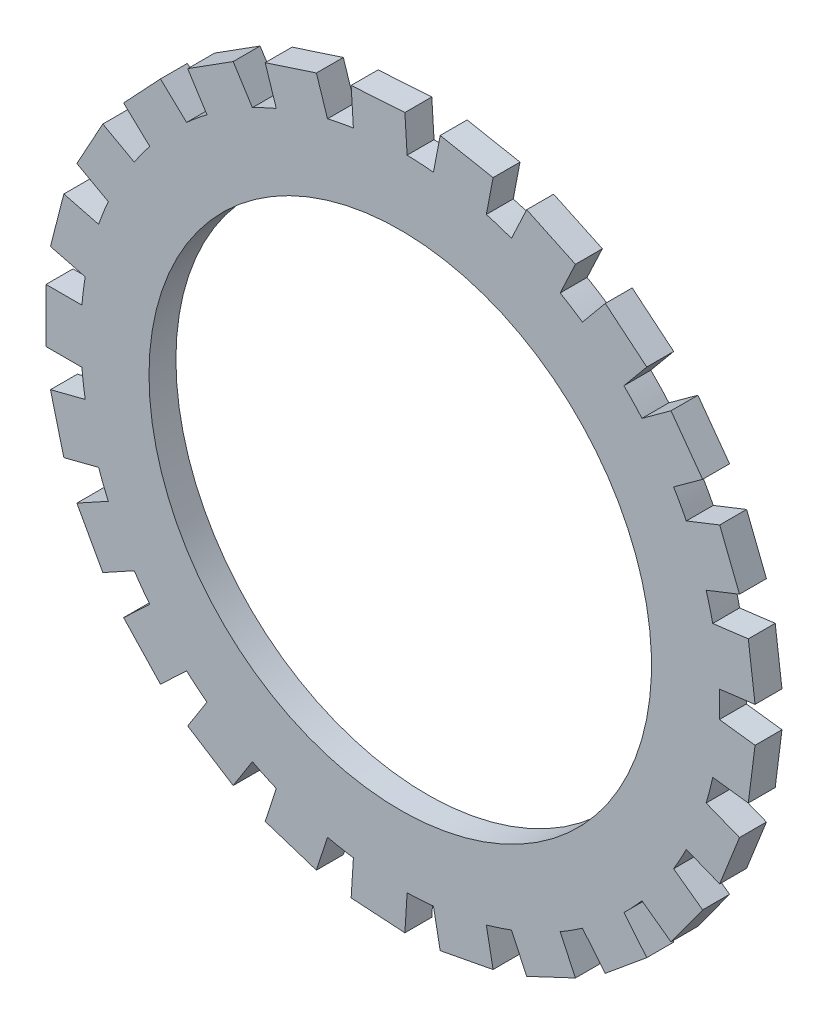
from build123d import *

# Parameters (mm, degrees)
SKETCH1_R           = 226.06
SKETCH1_R_2         = 177.8
BOSS_EXTRUDE1_DEPTH = 19.05
BOSS_EXTRUDE2_START = -19.05
BOSS_EXTRUDE2_DEPTH = 19.05


with BuildPart() as part:
    # Sketch1 → Boss-Extrude1 (new body)
    with BuildSketch(Plane.XY):
        with Locations(Location((0, 0, 0), (0, 0, 180))):
            Circle(SKETCH1_R)
        with Locations(Location((0, 0, 0), (0, 0, 180))):
            Circle(SKETCH1_R_2, mode=Mode.SUBTRACT)
    extrude(amount=BOSS_EXTRUDE1_DEPTH)

    # Sketch2 → Boss-Extrude2 (add)
    with BuildSketch(Plane.XY.offset(19.05).offset(BOSS_EXTRUDE2_START)):
        with BuildLine():
            Line((-250.655901366, 19.05), (-225.255901366, 19.05))
            ThreePointArc((-225.255901366, 19.05), (-226.06, 0), (-225.255901366, -19.05))
            Line((-225.255901366, -19.05), (-250.655901366, -19.05))
            Line((-250.655901366, -19.05), (-250.655901366, 19.05))
        make_face()
        with BuildLine():
            Line((-247.518627651, 43.884078608), (-222.916615358, 37.567355474))
            ThreePointArc((-222.916615358, 37.567355474), (-218.957909405, 56.218835892), (-213.441530657, 74.470373913))
            Line((-213.441530657, 74.470373913), (-238.04354295, 80.787097047))
            Line((-238.04354295, 80.787097047), (-247.518627651, 43.884078608))
        make_face()
        with BuildLine():
            Line((-228.828848251, 104.060759163), (-206.570658578, 91.824215841))
            ThreePointArc((-206.570658578, 91.824215841), (-198.097888091, 108.905235567), (-188.215843594, 125.211500351))
            Line((-188.215843594, 125.211500351), (-210.474033267, 137.448043673))
            Line((-210.474033267, 137.448043673), (-228.828848251, 104.060759163))
        make_face()
        with BuildLine():
            Line((-195.760910741, 157.698919511), (-177.245107605, 140.311423021))
            ThreePointArc((-177.245107605, 140.311423021), (-164.790647915, 154.748718766), (-151.163862869, 168.085127726))
            Line((-151.163862869, 168.085127726), (-169.679666006, 185.472624216))
            Line((-169.679666006, 185.472624216), (-195.760910741, 157.698919511))
        make_face()
        with BuildLine():
            Line((-150.392595252, 201.42827677), (-136.78259466, 179.982347463))
            ThreePointArc((-136.78259466, 179.982347463), (-121.129005273, 190.868770839), (-104.613700698, 200.397348351))
            Line((-104.613700698, 200.397348351), (-118.22370129, 221.843277659))
            Line((-118.22370129, 221.843277659), (-150.392595252, 201.42827677))
        make_face()
        with BuildLine():
            Line((-95.574559898, 232.501154599), (-87.725528241, 208.344319085))
            ThreePointArc((-87.725528241, 208.344319085), (-69.856381748, 214.995836074), (-51.49027497, 220.11786657))
            Line((-51.49027497, 220.11786657), (-59.339306627, 244.274702084))
            Line((-59.339306627, 244.274702084), (-95.574559898, 232.501154599))
        make_face()
        with BuildLine():
            Line((-34.751223446, 248.965129804), (-33.15634425, 223.615250902))
            ThreePointArc((-33.15634425, 223.615250902), (-14.194424845, 225.613922228), (4.868474103, 226.007569696))
            Line((4.868474103, 226.007569696), (3.273594907, 251.357448598))
            Line((3.273594907, 251.357448598), (-34.751223446, 248.965129804))
        make_face()
        with BuildLine():
            Line((28.25566018, 249.785710274), (23.49617479, 224.835614106))
            ThreePointArc((23.49617479, 224.835614106), (42.359419975, 222.0558559), (60.921319042, 217.69638602))
            Line((60.921319042, 217.69638602), (65.680804433, 242.646482188))
            Line((65.680804433, 242.646482188), (28.25566018, 249.785710274))
        make_face()
        with BuildLine():
            Line((89.487136761, 234.91133592), (78.672342755, 211.928728787))
            ThreePointArc((78.672342755, 211.928728787), (96.251666651, 204.54520348), (113.146253454, 195.706537779))
            Line((113.146253454, 195.706537779), (123.96104746, 218.689144911))
            Line((123.96104746, 218.689144911), (89.487136761, 234.91133592))
        make_face()
        with BuildLine():
            Line((145.095807428, 205.276618387), (128.905238088, 185.70558202))
            ThreePointArc((128.905238088, 185.70558202), (144.096067123, 174.182223662), (158.261792638, 161.419728011))
            Line((158.261792638, 161.419728011), (174.452361977, 180.990764377))
            Line((174.452361977, 180.990764377), (145.095807428, 205.276618387))
        make_face()
        with BuildLine():
            Line((191.587574889, 162.743615966), (171.038543232, 147.813870557))
            ThreePointArc((171.038543232, 147.813870557), (182.886381748, 132.874734133), (193.433161344, 116.990323072))
            Line((193.433161344, 116.990323072), (213.982193001, 131.92006848))
            Line((213.982193001, 131.92006848), (191.587574889, 162.743615966))
        make_face()
        with BuildLine():
            Line((226.04119041, 109.984833624), (202.424867669, 100.634469986))
            ThreePointArc((202.424867669, 100.634469986), (210.1852724, 83.21823638), (216.450413126, 65.209985874))
            Line((216.450413126, 65.209985874), (240.066735867, 74.560349512))
            Line((240.066735867, 74.560349512), (226.04119041, 109.984833624))
        make_face()
        with BuildLine():
            Line((246.291806617, 50.31529969), (221.092093203, 47.131835558))
            ThreePointArc((221.092093203, 47.131835558), (224.277449379, 28.33283078), (225.867289402, 9.332265438))
            Line((225.867289402, 9.332265438), (251.067002815, 12.51572957))
            Line((251.067002815, 12.51572957), (246.291806617, 50.31529969))
        make_face()
        with BuildLine():
            Line((251.067002815, -12.51572957), (225.867289402, -9.332265438))
            ThreePointArc((225.867289402, -9.332265438), (224.277449379, -28.33283078), (221.092093203, -47.131835558))
            Line((221.092093203, -47.131835558), (246.291806617, -50.31529969))
            Line((246.291806617, -50.31529969), (251.067002815, -12.51572957))
        make_face()
        with BuildLine():
            Line((240.066735867, -74.560349512), (216.450413126, -65.209985874))
            ThreePointArc((216.450413126, -65.209985874), (210.1852724, -83.21823638), (202.424867669, -100.634469986))
            Line((202.424867669, -100.634469986), (226.04119041, -109.984833624))
            Line((226.04119041, -109.984833624), (240.066735867, -74.560349512))
        make_face()
        with BuildLine():
            Line((213.982193001, -131.92006848), (193.433161344, -116.990323072))
            ThreePointArc((193.433161344, -116.990323072), (182.886381748, -132.874734133), (171.038543232, -147.813870557))
            Line((171.038543232, -147.813870557), (191.587574889, -162.743615966))
            Line((191.587574889, -162.743615966), (213.982193001, -131.92006848))
        make_face()
        with BuildLine():
            Line((174.452361977, -180.990764377), (158.261792638, -161.419728011))
            ThreePointArc((158.261792638, -161.419728011), (144.096067123, -174.182223662), (128.905238088, -185.70558202))
            Line((128.905238088, -185.70558202), (145.095807428, -205.276618387))
            Line((145.095807428, -205.276618387), (174.452361977, -180.990764377))
        make_face()
        with BuildLine():
            Line((123.961047459, -218.689144911), (113.146253454, -195.706537779))
            ThreePointArc((113.146253454, -195.706537779), (96.251666651, -204.54520348), (78.672342755, -211.928728787))
            Line((78.672342755, -211.928728787), (89.487136761, -234.91133592))
            Line((89.487136761, -234.91133592), (123.961047459, -218.689144911))
        make_face()
        with BuildLine():
            Line((65.680804433, -242.646482188), (60.921319042, -217.69638602))
            ThreePointArc((60.921319042, -217.69638602), (42.359419975, -222.0558559), (23.49617479, -224.835614106))
            Line((23.49617479, -224.835614106), (28.25566018, -249.785710274))
            Line((28.25566018, -249.785710274), (65.680804433, -242.646482188))
        make_face()
        with BuildLine():
            Line((3.273594907, -251.357448598), (4.868474103, -226.007569696))
            ThreePointArc((4.868474103, -226.007569696), (-14.194424845, -225.613922228), (-33.15634425, -223.615250902))
            Line((-33.15634425, -223.615250902), (-34.751223446, -248.965129804))
            Line((-34.751223446, -248.965129804), (3.273594907, -251.357448598))
        make_face()
        with BuildLine():
            Line((-59.339306627, -244.274702084), (-51.49027497, -220.11786657))
            ThreePointArc((-51.49027497, -220.11786657), (-69.856381748, -214.995836074), (-87.725528241, -208.344319085))
            Line((-87.725528241, -208.344319085), (-95.574559898, -232.501154599))
            Line((-95.574559898, -232.501154599), (-59.339306627, -244.274702084))
        make_face()
        with BuildLine():
            Line((-118.22370129, -221.843277659), (-104.613700698, -200.397348351))
            ThreePointArc((-104.613700698, -200.397348351), (-121.129005273, -190.868770839), (-136.78259466, -179.982347463))
            Line((-136.78259466, -179.982347463), (-150.392595252, -201.42827677))
            Line((-150.392595252, -201.42827677), (-118.22370129, -221.843277659))
        make_face()
        with BuildLine():
            Line((-169.679666006, -185.472624216), (-151.163862869, -168.085127726))
            ThreePointArc((-151.163862869, -168.085127726), (-164.790647915, -154.748718766), (-177.245107605, -140.311423021))
            Line((-177.245107605, -140.311423021), (-195.760910741, -157.698919511))
            Line((-195.760910741, -157.698919511), (-169.679666006, -185.472624216))
        make_face()
        with BuildLine():
            Line((-210.474033267, -137.448043673), (-188.215843594, -125.211500351))
            ThreePointArc((-188.215843594, -125.211500351), (-198.097888091, -108.905235567), (-206.570658578, -91.824215841))
            Line((-206.570658578, -91.824215841), (-228.828848251, -104.060759163))
            Line((-228.828848251, -104.060759163), (-210.474033267, -137.448043673))
        make_face()
        with BuildLine():
            Line((-238.04354295, -80.787097047), (-213.441530657, -74.470373913))
            ThreePointArc((-213.441530657, -74.470373913), (-218.957909405, -56.218835892), (-222.916615358, -37.567355474))
            Line((-222.916615358, -37.567355474), (-247.518627651, -43.884078608))
            Line((-247.518627651, -43.884078608), (-238.04354295, -80.787097047))
        make_face()
    extrude(amount=BOSS_EXTRUDE2_DEPTH)


solid = part.part
